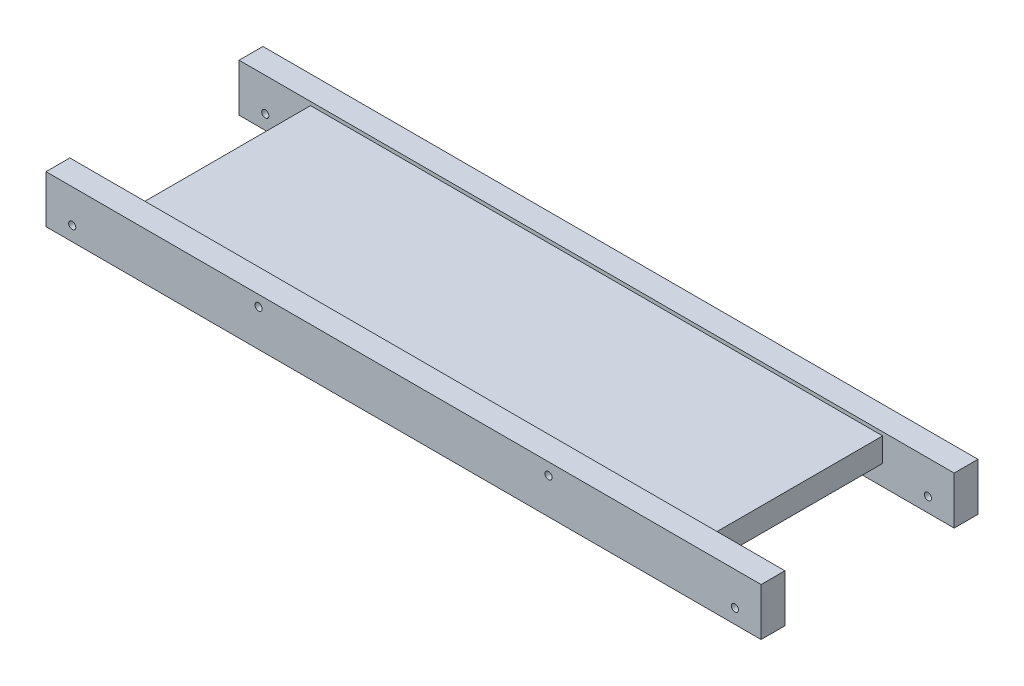
from build123d import *

# Parameters (mm, degrees)
CROQUIS1_W              = 300
CROQUIS1_H              = 20
CROQUIS1_R              = 1.5
SALIENTE_EXTRUIR1_DEPTH = 10
CROQUIS2_W              = 240
CROQUIS2_H              = 10
SALIENTE_EXTRUIR2_DEPTH = 71
SALIENTE_EXTRUIR3_START = 10
CROQUIS3_W              = 300
CROQUIS3_H              = 20
CROQUIS3_R              = 1.5
SALIENTE_EXTRUIR3_DEPTH = 10
CROQUIS6_R              = 1.5
CORTAR_EXTRUIR1_DEPTH   = 176.72990639


with BuildPart() as part:
    # Croquis1 → Saliente-Extruir1 (new body)
    with BuildSketch(Plane.XY):
        Rectangle(CROQUIS1_W, CROQUIS1_H)
        with Locations((-139, -4)):
            Circle(CROQUIS1_R, mode=Mode.SUBTRACT)
        with Locations(Location((139, -4, 0), (0, 0, 180))):
            Circle(CROQUIS1_R, mode=Mode.SUBTRACT)
    extrude(amount=-SALIENTE_EXTRUIR1_DEPTH)

    # Croquis2 → Saliente-Extruir2 (add)
    with BuildSketch(Plane.XY):
        with Locations((0, 3.5)):
            Rectangle(CROQUIS2_W, CROQUIS2_H)
    extrude(amount=SALIENTE_EXTRUIR2_DEPTH)

    # Croquis3 → Saliente-Extruir3 (add)
    with BuildSketch(Plane.XY.offset(71).offset(SALIENTE_EXTRUIR3_START)):
        Rectangle(CROQUIS3_W, CROQUIS3_H)
        with Locations((-139, -4)):
            Circle(CROQUIS3_R, mode=Mode.SUBTRACT)
        with Locations(Location((139, -4, 0), (0, 0, 180))):
            Circle(CROQUIS3_R, mode=Mode.SUBTRACT)
    extrude(amount=-SALIENTE_EXTRUIR3_DEPTH)

    # Croquis6 → Cortar-Extruir1 (cut, through all)
    with BuildSketch(Plane(origin=(0, 0, -10), x_dir=(-1, 0, 0), z_dir=(0, 0, -1))):
        with Locations((-60.8276255, 5)):
            Circle(CROQUIS6_R)
        with Locations((60.827625106, 5.478335841)):
            Circle(CROQUIS6_R)
    extrude(amount=-CORTAR_EXTRUIR1_DEPTH, mode=Mode.SUBTRACT)


solid = part.part
